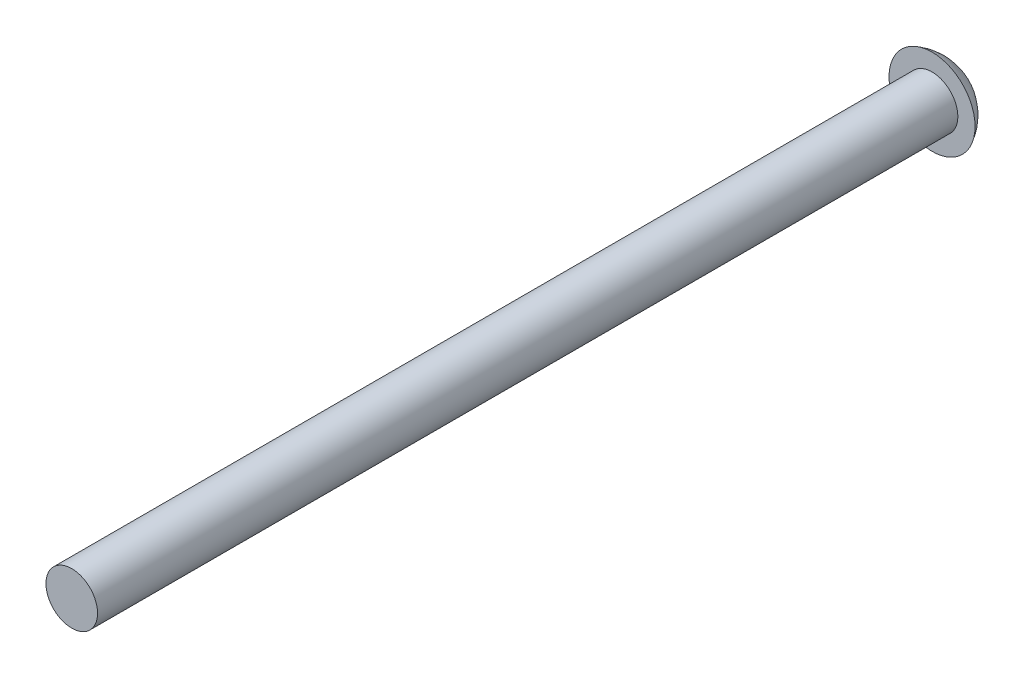
from build123d import *

# Parameters (mm, degrees)
SKETCH_1_R      = 3
EXTRUDE_1_DEPTH = 100


with BuildPart() as part:
    # 草图1 → 凸台-拉伸1 (new body)
    with BuildSketch(Plane.XY):
        Circle(SKETCH_1_R)
    extrude(amount=EXTRUDE_1_DEPTH)

    # 草图2 → 旋转1 (revolve)
    with BuildSketch(Plane(origin=(0, 0, 0), x_dir=(1, 0, 0), z_dir=(0, 1, 0))):
        with BuildLine():
            Line((0, 0), (5, 0))
            ThreePointArc((5, 0), (2.915475947, 2.192459912), (0, 3))
            Line((0, 3), (0, 0))
        make_face()
    revolve(axis=Axis((0, 0, 0), (0, 0, -1)))


solid = part.part
